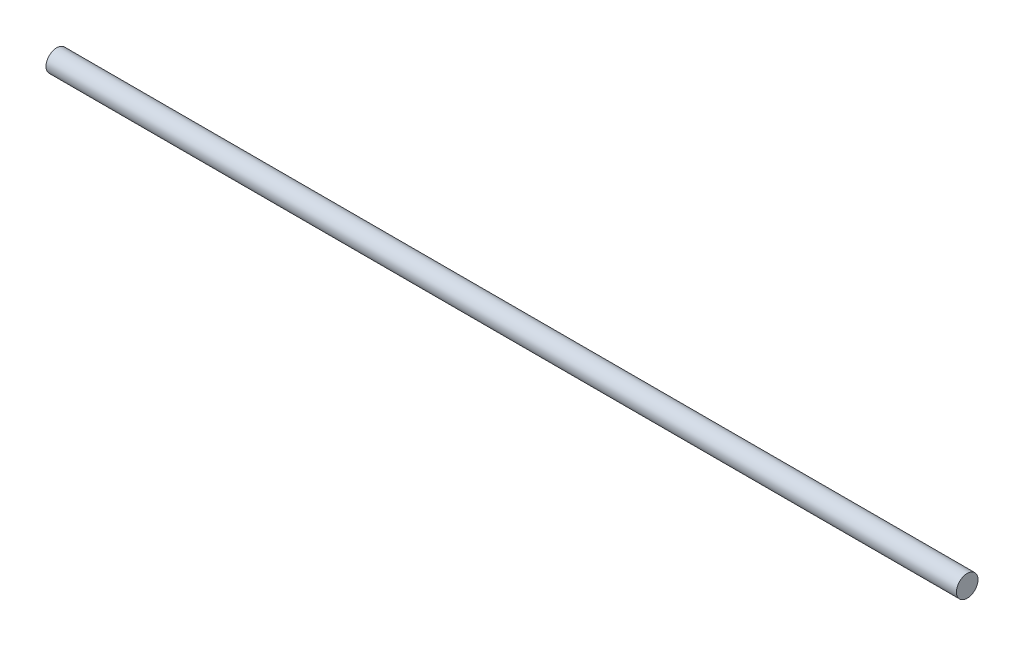
from build123d import *

# Parameters (mm, degrees)
SKETCH1_W = 536
SKETCH1_H = 6.35


with BuildPart() as part:
    # Sketch1 → Revolve1 (revolve)
    with BuildSketch(Plane.XY, mode=Mode.PRIVATE) as revolve1_sk:
        with Locations((0, 3.175)):
            Rectangle(SKETCH1_W, SKETCH1_H)
    revolve(revolve1_sk.sketch.rotate(Axis((0, 0, 0), (1, 0, 0)), 90), axis=Axis((0, 0, 0), (1, 0, 0)))


solid = part.part
